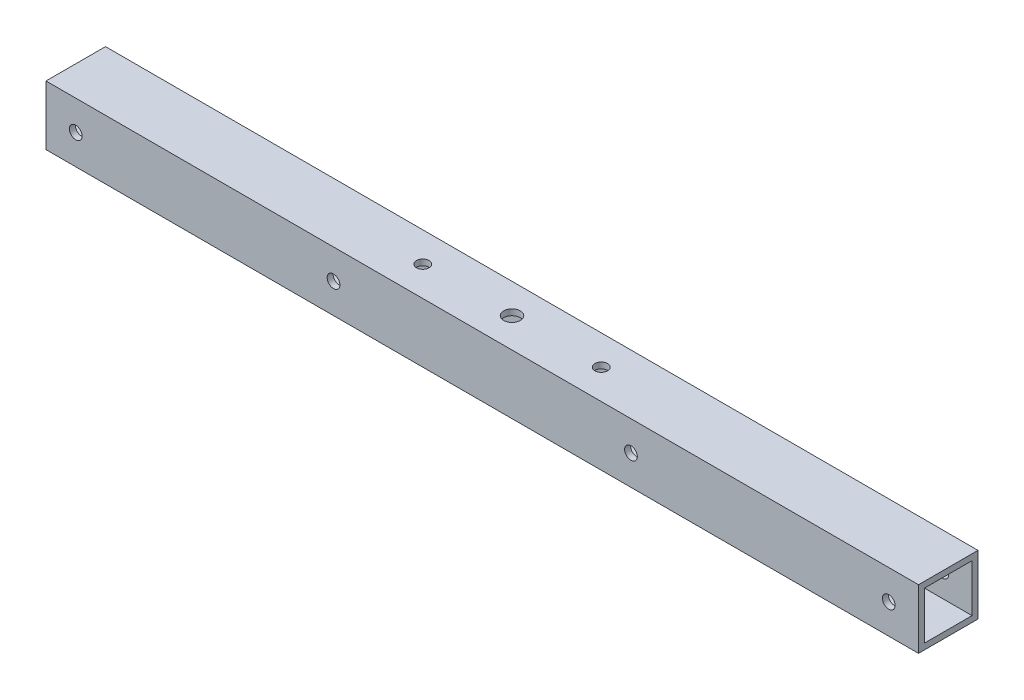
from build123d import *

# Parameters (mm, degrees)
SKETCH_1_W          = 15
SKETCH_1_H          = 15
SKETCH_1_W_2        = 12
SKETCH_1_H_2        = 12
EXTRUDE_1_DEPTH     = 220
SKETCH_3_R          = 1.6
CUT_EXTRUDE_2_DEPTH = 221.638278637
SKETCH_4_R          = 2.1
SKETCH_4_R_2        = 1.6
CUT_EXTRUDE_3_DEPTH = 221.638278637


with BuildPart() as part:
    # ｽｹｯﾁ1 → ﾎﾞｽ - 押し出し1 (new body)
    with BuildSketch(Plane(origin=(0, 0, 0), x_dir=(0, 0, -1), z_dir=(1, 0, 0))):
        Rectangle(SKETCH_1_W, SKETCH_1_H)
        Rectangle(SKETCH_1_W_2, SKETCH_1_H_2, mode=Mode.SUBTRACT)
    extrude(amount=EXTRUDE_1_DEPTH)

    # ｽｹｯﾁ3 → ｶｯﾄ - 押し出し2 (cut, through all)
    with BuildSketch(Plane.XY.offset(7.5)):
        with Locations((7.5, 0)):
            Circle(SKETCH_3_R)
        with Locations((212.5, 0)):
            Circle(SKETCH_3_R)
        with Locations((72.5, 0)):
            Circle(SKETCH_3_R)
        with Locations((147.5, 0)):
            Circle(SKETCH_3_R)
    extrude(amount=-CUT_EXTRUDE_2_DEPTH, mode=Mode.SUBTRACT)

    # ｽｹｯﾁ4 → ｶｯﾄ - 押し出し3 (cut, through all)
    with BuildSketch(Plane(origin=(0, 7.5, 0), x_dir=(1, 0, 0), z_dir=(0, 1, 0))):
        with Locations(Location((110, 0, 0), (0, 0, 270))):
            Circle(SKETCH_4_R)
        with Locations(Location((132.5, 0, 0), (0, 0, 270))):
            Circle(SKETCH_4_R_2)
        with Locations(Location((87.5, 0, 0), (0, 0, 270))):
            Circle(SKETCH_4_R_2)
    extrude(amount=-CUT_EXTRUDE_3_DEPTH, mode=Mode.SUBTRACT)


solid = part.part
